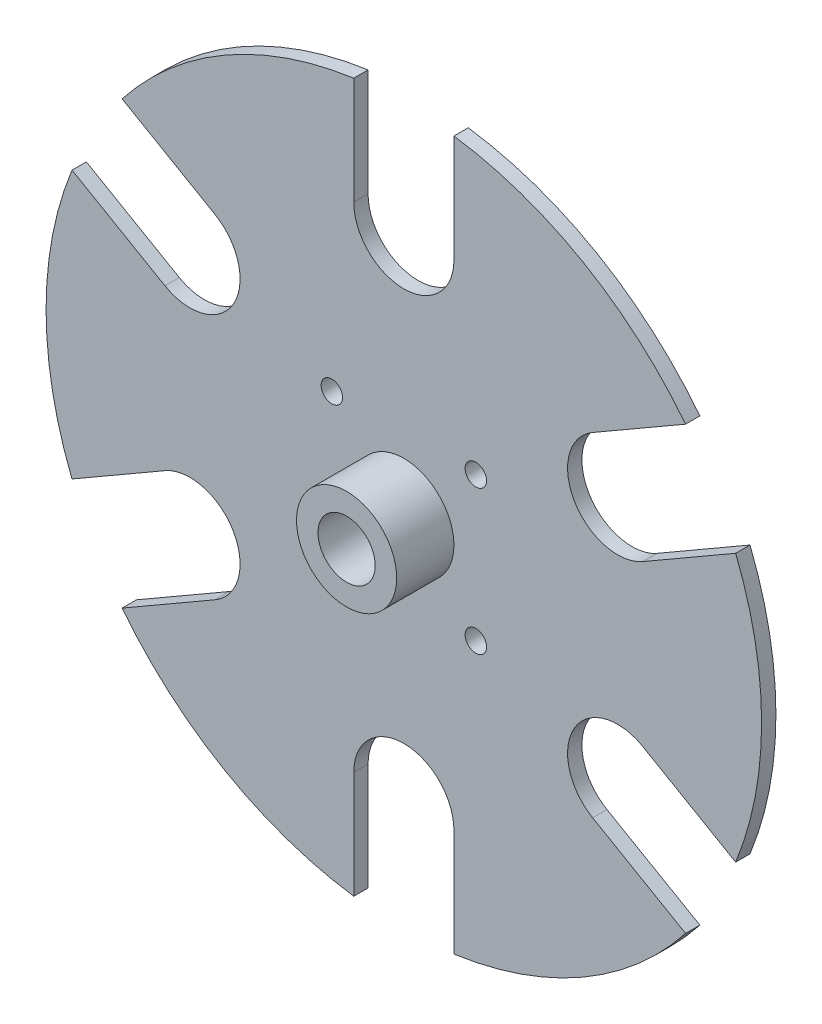
from build123d import *

# Parameters (mm, degrees)
SKETCH1_R               = 20
SKETCH1_R_2             = 4
SKETCH1_R_3             = 1.5
BOSS_EXTRUDE1_DEPTH     = 5
SKETCH2_R               = 7
SKETCH2_R_2             = 4
BOSS_EXTRUDE2_DEPTH     = 10
SKETCH3_R               = 50
SKETCH3_R_2             = 4
BOSS_EXTRUDE3_DEPTH     = 2
CUT_EXTRUDE1_START      = -2
CUT_EXTRUDE1_DEPTH      = 2
CUT_EXTRUDE2_DEPTH      = 72.944422994
CUT_EXTRUDE2_DEPTH_BACK = 72.944422994
SKETCH5_R               = 1.5


with BuildPart() as part:
    # Sketch1 → Boss-Extrude1 (new body)
    with BuildSketch(Plane.XY):
        Circle(SKETCH1_R)
        Circle(SKETCH1_R_2, mode=Mode.SUBTRACT)
        with Locations((-10.061951403, 10.061951403)):
            Circle(SKETCH1_R_3, mode=Mode.SUBTRACT)
        with Locations(Location((10.061951403, 10.061951403, 0), (0, 0, 180))):
            Circle(SKETCH1_R_3, mode=Mode.SUBTRACT)
        with Locations((10.061951403, -10.061951403)):
            Circle(SKETCH1_R_3, mode=Mode.SUBTRACT)
        with Locations(Location((-10.061951403, -10.061951403, 0), (0, 0, 180))):
            Circle(SKETCH1_R_3, mode=Mode.SUBTRACT)
    extrude(amount=BOSS_EXTRUDE1_DEPTH)

    # Sketch2 → Boss-Extrude2 (add)
    with BuildSketch(Plane.XY.offset(5)):
        Circle(SKETCH2_R)
        Circle(SKETCH2_R_2, mode=Mode.SUBTRACT)
    extrude(amount=BOSS_EXTRUDE2_DEPTH)

    # Sketch3 → Boss-Extrude3 (add)
    with BuildSketch(Plane.XY.offset(5)):
        Circle(SKETCH3_R)
        Circle(SKETCH3_R_2, mode=Mode.SUBTRACT)
    extrude(amount=BOSS_EXTRUDE3_DEPTH)

    # Sketch4 → Cut-Extrude1 (cut)
    with BuildSketch(Plane.XY.offset(7).offset(CUT_EXTRUDE1_START)):
        with BuildLine():
            Line((-7, 49.507575178), (-7, 34.507575178))
            ThreePointArc((-7, 34.507575178), (0, 27.507575178), (7, 34.507575178))
            Line((7, 34.507575178), (7, 49.507575178))
            ThreePointArc((7, 49.507575178), (0, 50), (-7, 49.507575178))
        make_face()
        with BuildLine():
            Line((39.374817784, 30.815965415), (26.384436727, 23.315965415))
            ThreePointArc((26.384436727, 23.315965415), (23.822258901, 13.753787589), (33.384436727, 11.191609762))
            Line((33.384436727, 11.191609762), (46.374817784, 18.691609762))
            ThreePointArc((46.374817784, 18.691609762), (43.301270189, 25), (39.374817784, 30.815965415))
        make_face()
        with BuildLine():
            Line((46.374817784, -18.691609762), (33.384436727, -11.191609762))
            ThreePointArc((33.384436727, -11.191609762), (23.822258901, -13.753787589), (26.384436727, -23.315965415))
            Line((26.384436727, -23.315965415), (39.374817784, -30.815965415))
            ThreePointArc((39.374817784, -30.815965415), (43.301270189, -25), (46.374817784, -18.691609762))
        make_face()
        with BuildLine():
            Line((7, -49.507575178), (7, -34.507575178))
            ThreePointArc((7, -34.507575178), (0, -27.507575178), (-7, -34.507575178))
            Line((-7, -34.507575178), (-7, -49.507575178))
            ThreePointArc((-7, -49.507575178), (0, -50), (7, -49.507575178))
        make_face()
        with BuildLine():
            Line((-39.374817784, -30.815965415), (-26.384436727, -23.315965415))
            ThreePointArc((-26.384436727, -23.315965415), (-23.822258901, -13.753787589), (-33.384436727, -11.191609762))
            Line((-33.384436727, -11.191609762), (-46.374817784, -18.691609762))
            ThreePointArc((-46.374817784, -18.691609762), (-43.301270189, -25), (-39.374817784, -30.815965415))
        make_face()
        with BuildLine():
            Line((-46.374817784, 18.691609762), (-33.384436727, 11.191609762))
            ThreePointArc((-33.384436727, 11.191609762), (-23.822258901, 13.753787589), (-26.384436727, 23.315965415))
            Line((-26.384436727, 23.315965415), (-39.374817784, 30.815965415))
            ThreePointArc((-39.374817784, 30.815965415), (-43.301270189, 25), (-46.374817784, 18.691609762))
        make_face()
    extrude(amount=CUT_EXTRUDE1_DEPTH, mode=Mode.SUBTRACT)

    # Sketch5 → Cut-Extrude2 (cut, two sides: drawn at the far end of the back side and taken through both)
    with BuildSketch(Plane(origin=(0, 0, 0), x_dir=(-1, 0, 0), z_dir=(0, 0, -1)).offset(-CUT_EXTRUDE2_DEPTH_BACK)):
        with Locations((-10.061951403, 10.061951403)):
            Circle(SKETCH5_R)
        with Locations(Location((-10.061951403, -10.061951403, 0), (0, 0, 180))):
            Circle(SKETCH5_R)
        with Locations(Location((10.061951403, 10.061951403, 0), (0, 0, 180))):
            Circle(SKETCH5_R)
        with Locations((10.061951403, -10.061951403)):
            Circle(SKETCH5_R)
    extrude(amount=CUT_EXTRUDE2_DEPTH + CUT_EXTRUDE2_DEPTH_BACK, mode=Mode.SUBTRACT)


solid = part.part
